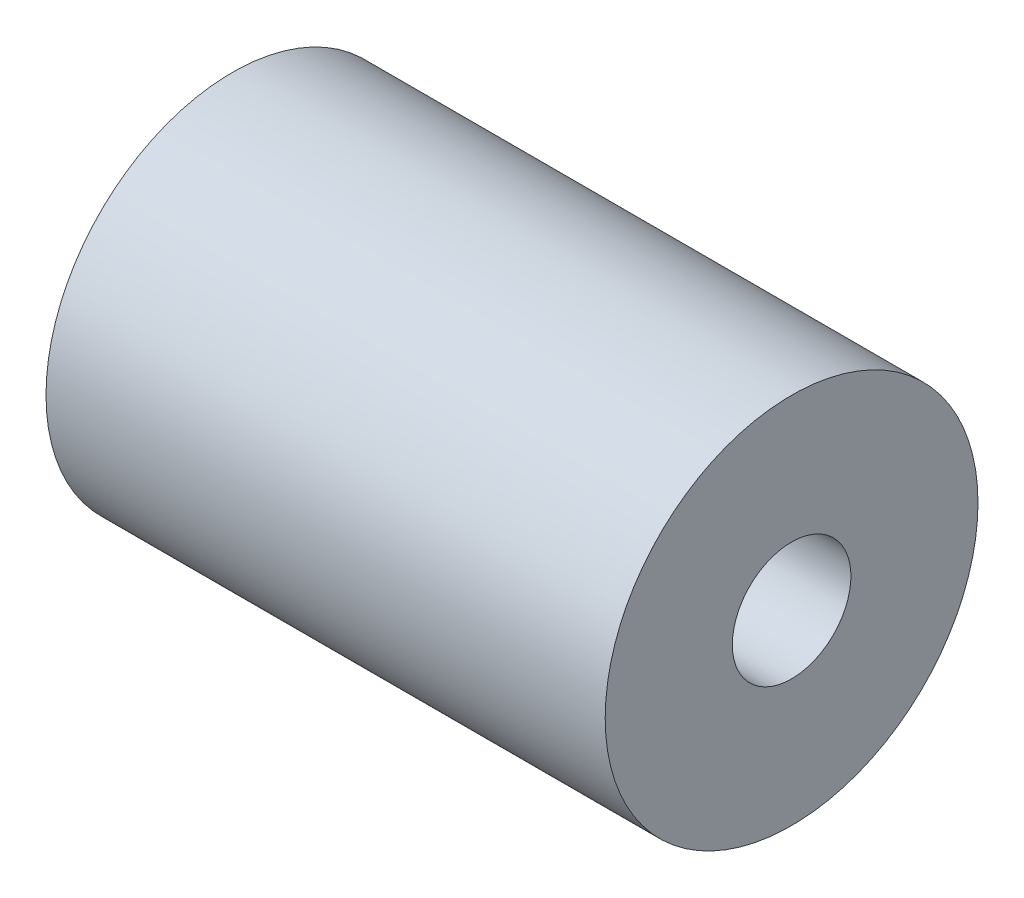
from build123d import *

# Parameters (mm, degrees)
SKETCH1_R           = 6.35
SKETCH1_R_2         = 2.0193
BOSS_EXTRUDE1_DEPTH = 19.05


with BuildPart() as part:
    # Sketch1 → Boss-Extrude1 (new body)
    with BuildSketch(Plane(origin=(0, 0, 0), x_dir=(0, 0, -1), z_dir=(1, 0, 0))):
        with Locations(Location((0, 0, 0), (0, 0, 180))):
            Circle(SKETCH1_R)
        with Locations(Location((0, 0, 0), (0, 0, 180))):
            Circle(SKETCH1_R_2, mode=Mode.SUBTRACT)
    extrude(amount=BOSS_EXTRUDE1_DEPTH)


solid = part.part
